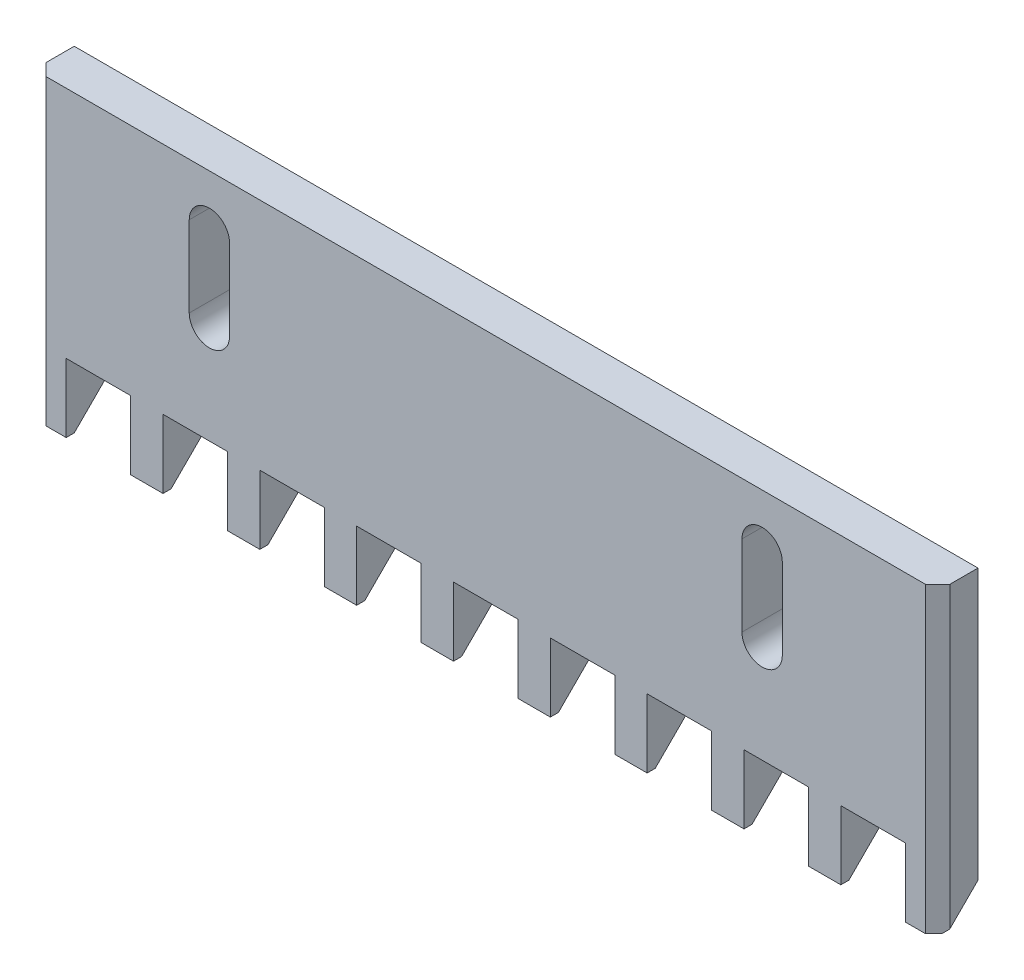
from build123d import *

# Parameters (mm, degrees)
SKETCH_1_W             = 224
SKETCH_1_H             = 75
EXTRUDE_1_DEPTH        = 10
CUT_EXTRUDE_1_DEPTH    = 119.533750468
CHAMFER_1_SIZE         = 8
SKETCH_3_W             = 16
SKETCH_3_H             = 17
CUT_EXTRUDE_2_DEPTH    = 119.533750468
CHAMFER_2_SIZE         = 3
PATTERN_LINEAR_1_COUNT = 5
PATTERN_LINEAR_1_PITCH = 24
PATTERN_LINEAR_2_COUNT = 5
PATTERN_LINEAR_2_PITCH = 24


with BuildPart() as part:
    # Эскиз1 → Бобышка-Вытянуть1 (new body)
    with BuildSketch(Plane.XY):
        Rectangle(SKETCH_1_W, SKETCH_1_H)
    extrude(amount=EXTRUDE_1_DEPTH)

    # Эскиз2 → Вырез-Вытянуть1 (cut, symmetric)
    with BuildSketch(Plane.XY.offset(10)):
        with BuildLine():
            Line((-73.5, 4.5), (-73.5, 24.5))
            ThreePointArc((-73.5, 24.5), (-68.5, 29.5), (-63.5, 24.5))
            Line((-63.5, 24.5), (-63.5, 4.5))
            ThreePointArc((-63.5, 4.5), (-68.5, -0.5), (-73.5, 4.5))
        make_face()
    cut_extrude_1 = extrude(amount=CUT_EXTRUDE_1_DEPTH, both=True, mode=Mode.SUBTRACT)

    # Фаска1
    chamfer_1_edges = [part.edges().sort_by_distance(p)[0] for p in [
        (0, -37.5, 0),
    ]]
    chamfer(chamfer_1_edges, length=CHAMFER_1_SIZE)

    # Эскиз3 → Вырез-Вытянуть2 (cut, symmetric)
    with BuildSketch(Plane.XY.offset(10)):
        with Locations((0, -29)):
            Rectangle(SKETCH_3_W, SKETCH_3_H)
    cut_extrude_2 = extrude(amount=CUT_EXTRUDE_2_DEPTH, both=True, mode=Mode.SUBTRACT)

    # Фаска2
    chamfer_2_edges = [part.edges().sort_by_distance(p)[0] for p in [
        (112, 0, 10),
        (-112, 0, 10),
    ]]
    chamfer(chamfer_2_edges, length=CHAMFER_2_SIZE)

    # Линейный массив1: Вырез-Вытянуть2 ×5
    with Locations(*[(-i * PATTERN_LINEAR_1_PITCH, 0, 0) for i in range(1, PATTERN_LINEAR_1_COUNT)]):
        add(cut_extrude_2, mode=Mode.SUBTRACT)

    # Линейный массив2: Вырез-Вытянуть2 ×5
    with Locations(*[(i * PATTERN_LINEAR_2_PITCH, 0, 0) for i in range(1, PATTERN_LINEAR_2_COUNT)]):
        add(cut_extrude_2, mode=Mode.SUBTRACT)

    # Зеркальное отражение2: Вырез-Вытянуть1 across plane
    add(cut_extrude_1.mirror(Plane(origin=(0, 0, 0), x_dir=(0, 0, 1), z_dir=(1, 0, 0))), mode=Mode.SUBTRACT)


solid = part.part
